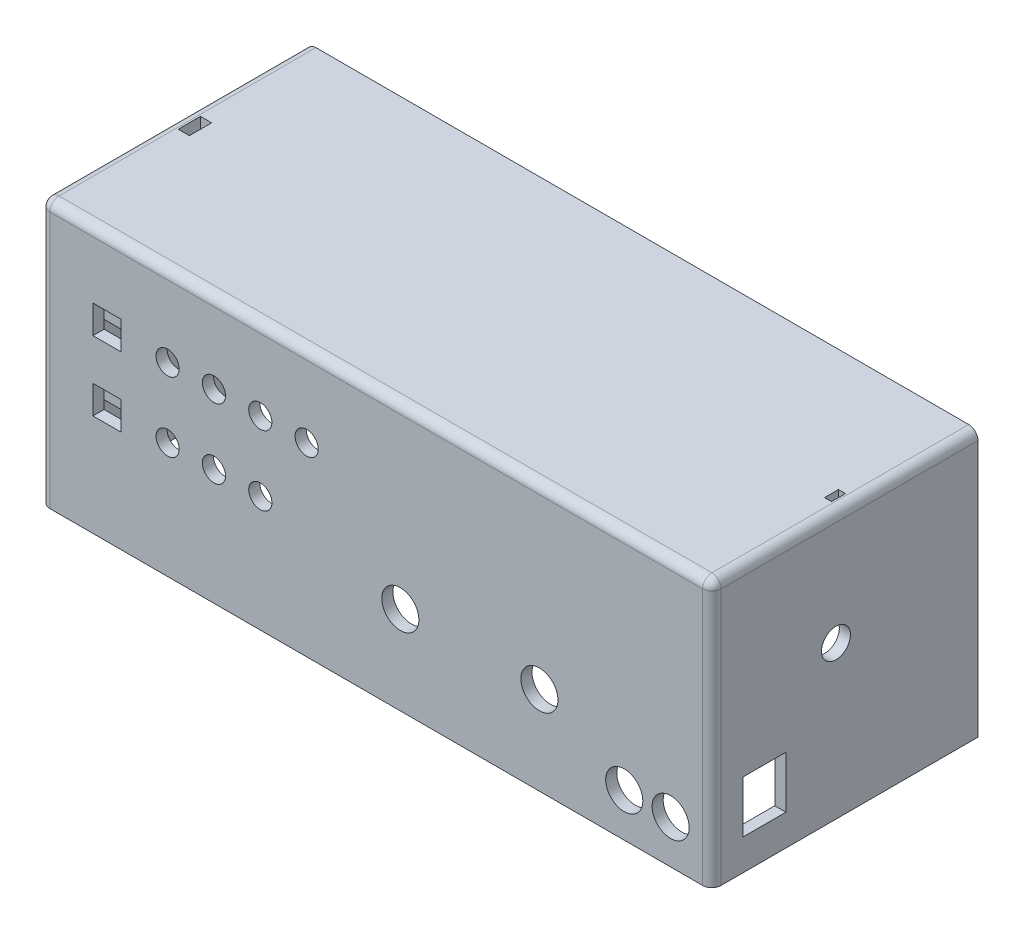
from build123d import *

# Parameters (mm, degrees)
BOSS_EXTRUDE1_DEPTH = 55
SKETCH3_W           = 9.2
SKETCH3_H           = 11.2
CUT_EXTRUDE1_DEPTH  = 2.4
SKETCH4_R           = 4
CUT_EXTRUDE2_DEPTH  = 2.4
SKETCH5_R           = 2.5
CUT_EXTRUDE3_DEPTH  = 2.4
SKETCH7_R           = 4
CUT_EXTRUDE4_DEPTH  = 2.4
SKETCH8_W           = 6.1
SKETCH8_H           = 6.1
CUT_EXTRUDE5_DEPTH  = 2.4
SKETCH9_W           = 12
SKETCH9_H           = 2.4
BOSS_EXTRUDE3_DEPTH = 2.4
SKETCH10_R          = 4
CUT_EXTRUDE6_DEPTH  = 2.4
BOSS_EXTRUDE4_DEPTH = 2.4
SKETCH12_W          = 1.5
SKETCH12_H          = 3
SKETCH12_W_2        = 2.4
SKETCH12_H_2        = 4.8
CUT_EXTRUDE7_DEPTH  = 2.4
SKETCH13_R          = 3.125
CUT_EXTRUDE8_DEPTH  = 2.4
FILLET1_R           = 2


with BuildPart() as part:
    # Sketch2 → Boss-Extrude1 (new body)
    with BuildSketch(Plane(origin=(0, 0, 0), x_dir=(1, 0, 0), z_dir=(0, 1, 0))):
        with BuildLine():
            Line((-70, 55), (-70, 0))
            Line((-70, 0), (70, 0))
            Line((70, 0), (70, 55))
            Line((70, 55), (72.4, 55))
            Line((72.4, 55), (72.4, -0.4))
            ThreePointArc((72.4, -0.4), (71.814213562, -1.814213562), (70.4, -2.4))
            Line((70.4, -2.4), (-70.4, -2.4))
            ThreePointArc((-70.4, -2.4), (-71.814213562, -1.814213562), (-72.4, -0.4))
            Line((-72.4, -0.4), (-72.4, 55))
            Line((-72.4, 55), (-70, 55))
        make_face()
    extrude(amount=BOSS_EXTRUDE1_DEPTH)

    # Sketch3 → Cut-Extrude1 (cut)
    with BuildSketch(Plane(origin=(72.4, 0, 0), x_dir=(0, 0, -1), z_dir=(1, 0, 0))):
        with Locations((8.964963507, 12.3)):
            Rectangle(SKETCH3_W, SKETCH3_H)
    extrude(amount=-CUT_EXTRUDE1_DEPTH, mode=Mode.SUBTRACT)

    # Sketch4 → Cut-Extrude2 (cut)
    with BuildSketch(Plane.XY.offset(2.4)):
        with Locations((53.50014494, 9.325)):
            Circle(SKETCH4_R)
        with Locations((35.20014494, 19.025)):
            Circle(SKETCH4_R)
    extrude(amount=-CUT_EXTRUDE2_DEPTH, mode=Mode.SUBTRACT)

    # Sketch5 → Cut-Extrude3 (cut)
    with BuildSketch(Plane.XY.offset(2.4)):
        with Locations((-45, 25)):
            Circle(SKETCH5_R)
        with Locations((-35, 25)):
            Circle(SKETCH5_R)
        with Locations((-25, 25)):
            Circle(SKETCH5_R)
        with Locations((-35, 40)):
            Circle(SKETCH5_R)
        with Locations((-25, 40)):
            Circle(SKETCH5_R)
        with Locations((-15, 40)):
            Circle(SKETCH5_R)
        with Locations((-45, 40)):
            Circle(SKETCH5_R)
    extrude(amount=-CUT_EXTRUDE3_DEPTH, mode=Mode.SUBTRACT)

    # Sketch7 → Cut-Extrude4 (cut)
    with BuildSketch(Plane.XY.offset(2.4)):
        with Locations((5.20014494, 19.025)):
            Circle(SKETCH7_R)
    extrude(amount=-CUT_EXTRUDE4_DEPTH, mode=Mode.SUBTRACT)

    # Sketch8 → Cut-Extrude5 (cut)
    with BuildSketch(Plane.XY.offset(2.4)):
        with Locations((-58.05, 25)):
            Rectangle(SKETCH8_W, SKETCH8_H)
        with Locations((-58.05, 40)):
            Rectangle(SKETCH8_W, SKETCH8_H)
    extrude(amount=-CUT_EXTRUDE5_DEPTH, mode=Mode.SUBTRACT)

    # Sketch9 → Boss-Extrude3 (add)
    with BuildSketch(Plane(origin=(0, 0, 0), x_dir=(-1, 0, 0), z_dir=(0, 0, -1))):
        with Locations((58.05, 25)):
            Rectangle(SKETCH9_W, SKETCH9_H)
        with Locations((58.05, 40)):
            Rectangle(SKETCH9_W, SKETCH9_H)
    extrude(amount=BOSS_EXTRUDE3_DEPTH)

    # Sketch10 → Cut-Extrude6 (cut)
    with BuildSketch(Plane.XY.offset(2.4)):
        with Locations((63.50014494, 9.325)):
            Circle(SKETCH10_R)
    extrude(amount=-CUT_EXTRUDE6_DEPTH, mode=Mode.SUBTRACT)

    # Sketch11 → Boss-Extrude4 (add)
    with BuildSketch(Plane(origin=(0, 55, 0), x_dir=(1, 0, 0), z_dir=(0, 1, 0))):
        with BuildLine():
            Line((-72.4, 55), (72.4, 55))
            Line((72.4, 55), (72.4, -0.4))
            ThreePointArc((72.4, -0.4), (71.814213562, -1.814213562), (70.4, -2.4))
            Line((70.4, -2.4), (-70.4, -2.4))
            ThreePointArc((-70.4, -2.4), (-71.814213562, -1.814213562), (-72.4, -0.4))
            Line((-72.4, -0.4), (-72.4, 55))
        make_face()
    extrude(amount=BOSS_EXTRUDE4_DEPTH)

    # Sketch12 → Cut-Extrude7 (cut)
    with BuildSketch(Plane(origin=(0, 57.4, 0), x_dir=(1, 0, 0), z_dir=(0, 1, 0))):
        with Locations((69.25, 27.3)):
            Rectangle(SKETCH12_W, SKETCH12_H)
        with Locations((-68.8, 27.3)):
            Rectangle(SKETCH12_W_2, SKETCH12_H_2)
    extrude(amount=-CUT_EXTRUDE7_DEPTH, mode=Mode.SUBTRACT)

    # Sketch13 → Cut-Extrude8 (cut)
    with BuildSketch(Plane(origin=(72.4, 0, 0), x_dir=(0, 0, -1), z_dir=(1, 0, 0))):
        with Locations((24.364963507, 32.9)):
            Circle(SKETCH13_R)
    extrude(amount=-CUT_EXTRUDE8_DEPTH, mode=Mode.SUBTRACT)

    # Fillet1
    fillet1_edges = [part.edges().sort_by_distance(p)[0] for p in [
        (-72.4, 57.4, -27.3),
        (-71.814213562, 57.4, 1.814213562),
        (0, 57.4, 2.4),
        (71.814213562, 57.4, 1.814213562),
        (72.4, 57.4, -27.3),
    ]]
    fillet(fillet1_edges, radius=FILLET1_R)


solid = part.part
